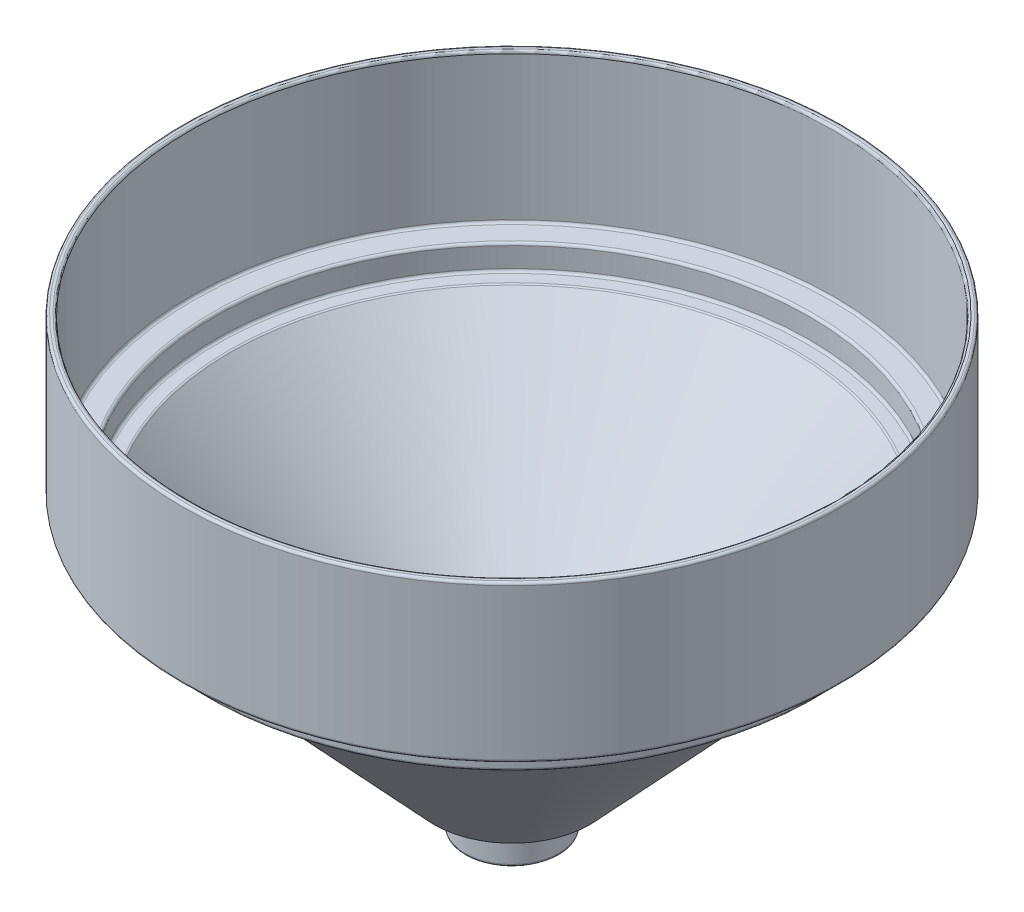
from build123d import *

# Parameters (mm, degrees)
FILLET1_R = 0.5


with BuildPart() as part:
    # Sketch1 → Revolve-Thin1 (revolve)
    with BuildSketch(Plane(origin=(0, 0, 0), x_dir=(0, 0, -1), z_dir=(1, 0, 0))):
        Polygon((65, 80), (65, 50), (60, 50), (60, 45), (57, 45), (15, 0), (8, 0), (8, -10), (9.5, -10), (9.5, -1.5), (15.651828453, -1.5), (57.651828453, 43.5), (61.5, 43.5), (61.5, 48.5), (66.5, 48.5), (66.5, 80), align=None)
    revolve(axis=Axis((0, 0, 0), (0, 1, 0)))

    # Fillet1
    fillet1_edges = [part.edges().sort_by_distance(p)[0] for p in [
        (0, 80, 66.5),
        (0, 80, 65),
        (0, 50, 65),
        (0, 50, 60),
        (0, 45, 60),
        (0, 45, 57),
        (0, 0, 15),
        (0, 0, 8),
        (0, -10, 8),
        (0, -10, 9.5),
        (0, -1.5, 9.5),
        (0, -1.5, 15.651828453),
        (0, 43.5, 57.651828453),
        (0, 43.5, 61.5),
        (0, 48.5, 61.5),
        (0, 48.5, 66.5),
    ]]
    fillet(fillet1_edges, radius=FILLET1_R)


solid = part.part
